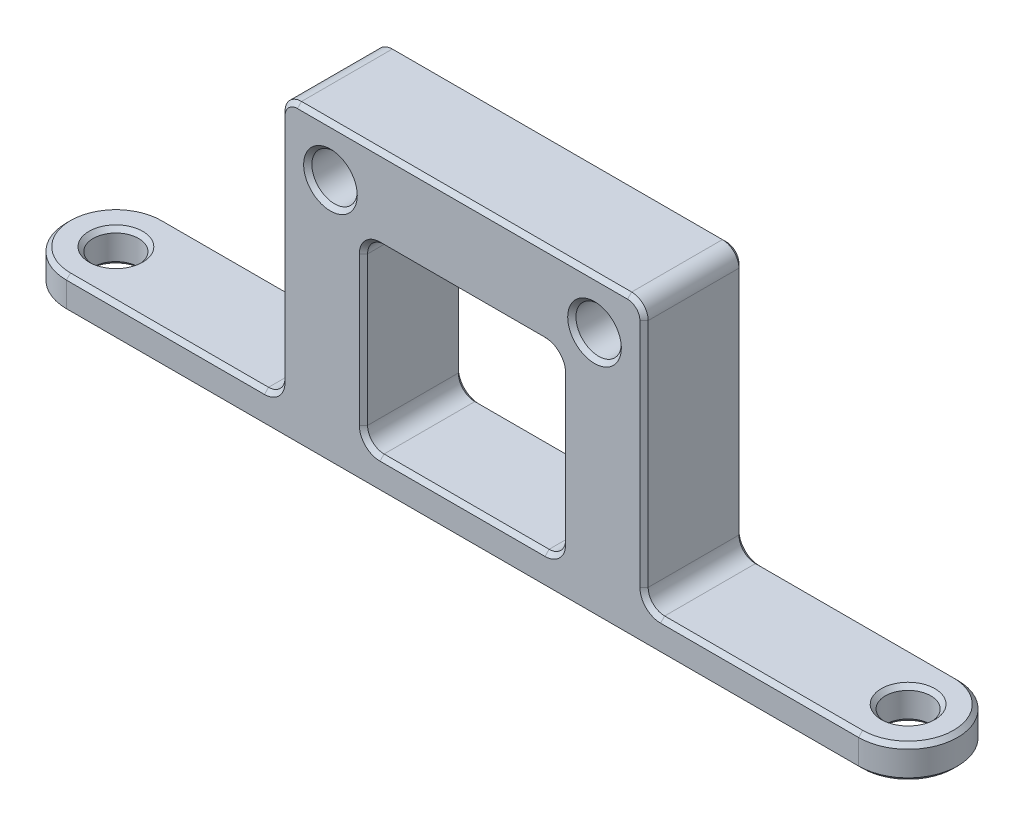
from build123d import *

# Parameters (mm, degrees)
SKETCH2_R               = 2.1828125
BOSS_EXTRUDE1_DEPTH     = 3.175
SKETCH3_W               = 36.843225838
SKETCH3_H               = 9.525
BOSS_EXTRUDE2_DEPTH     = 25.4
CUT_EXTRUDE1_DEPTH      = 53.3875
CUT_EXTRUDE1_DEPTH_BACK = 53.3875
SKETCH4_R               = 2.1828125
SKETCH4_W               = 0.959112919
SKETCH4_H               = 25.4
SKETCH4_W_2             = 19.05
SKETCH4_H_2             = 17.4625
FILLET1_R               = 1.5875
CHAMFER1_SIZE           = 0.396875


with BuildPart() as part:
    # Sketch2 → Boss-Extrude1 (new body)
    with BuildSketch(Plane(origin=(0, 0, 0), x_dir=(1, 0, 0), z_dir=(0, 1, 0))):
        with BuildLine():
            Line((-38.1, 4.7625), (38.1, 4.7625))
            ThreePointArc((38.1, 4.7625), (42.8625, 0), (38.1, -4.7625))
            Line((38.1, -4.7625), (-38.1, -4.7625))
            ThreePointArc((-38.1, -4.7625), (-42.8625, 0), (-38.1, 4.7625))
        make_face()
        with Locations(Location((-38.1, 0, 0), (0, 0, 270))):
            Circle(SKETCH2_R, mode=Mode.SUBTRACT)
        with Locations(Location((38.1, 0, 0), (0, 0, 270))):
            Circle(SKETCH2_R, mode=Mode.SUBTRACT)
    extrude(amount=BOSS_EXTRUDE1_DEPTH)

    # Sketch3 → Boss-Extrude2 (add)
    with BuildSketch(Plane(origin=(0, 3.175, 0), x_dir=(1, 0, 0), z_dir=(0, 1, 0))):
        Rectangle(SKETCH3_W, SKETCH3_H)
    extrude(amount=BOSS_EXTRUDE2_DEPTH)

    # Sketch4 → Cut-Extrude1 (cut, two sides: drawn at the far end of the back side and taken through both)
    with BuildSketch(Plane.XY.offset(4.7625).offset(-CUT_EXTRUDE1_DEPTH_BACK)):
        with Locations((-12.7, 23.8125)):
            Circle(SKETCH4_R)
        with Locations((12.7, 23.8125)):
            Circle(SKETCH4_R)
        with Locations((-17.94205646, 15.875)):
            Rectangle(SKETCH4_W, SKETCH4_H)
        with Locations((17.94205646, 15.875)):
            Rectangle(SKETCH4_W, SKETCH4_H)
        with Locations((0, 11.90625)):
            Rectangle(SKETCH4_W_2, SKETCH4_H_2)
    extrude(amount=CUT_EXTRUDE1_DEPTH + CUT_EXTRUDE1_DEPTH_BACK, mode=Mode.SUBTRACT)

    # Fillet1
    fillet1_edges = [part.edges().sort_by_distance(p)[0] for p in [
        (-17.4625, 3.175, 0),
        (-17.4625, 28.575, 0),
        (17.4625, 28.575, 0),
        (17.4625, 3.175, 0),
        (-9.525, 3.175, 0),
        (-9.525, 20.6375, 0),
        (9.525, 20.6375, 0),
        (9.525, 3.175, 0),
    ]]
    fillet(fillet1_edges, radius=FILLET1_R)

    # Chamfer1
    chamfer1_edges = [part.edges().sort_by_distance(p)[0] for p in [
        (0, 28.575, -4.7625),
        (0, 28.575, 4.7625),
        (0, 3.175, 4.7625),
        (-9.525, 11.90625, 4.7625),
        (0, 20.6375, 4.7625),
        (9.525, 11.90625, 4.7625),
        (-17.4625, 15.875, 4.7625),
        (28.575, 3.175, 4.7625),
        (17.4625, 15.875, 4.7625),
        (16.997532015, 28.110032015, 4.7625),
        (-16.997532015, 28.110032015, 4.7625),
        (-17.4625, 15.875, -4.7625),
        (0, 20.6375, -4.7625),
        (-9.525, 11.90625, -4.7625),
        (0, 3.175, -4.7625),
        (9.525, 11.90625, -4.7625),
        (-28.575, 3.175, -4.7625),
        (17.4625, 15.875, -4.7625),
        (16.997532015, 28.110032015, -4.7625),
        (-16.997532015, 28.110032015, -4.7625),
        (-38.1, 0, -2.1828125),
        (-17.927467985, 3.639967985, 4.7625),
        (-38.1, 3.175, -2.1828125),
        (-17.927467985, 3.639967985, -4.7625),
        (17.927467985, 3.639967985, 4.7625),
        (17.927467985, 3.639967985, -4.7625),
        (-9.060032015, 20.172532015, 4.7625),
        (42.8625, 3.175, 0),
        (-9.060032015, 20.172532015, -4.7625),
        (9.060032015, 20.172532015, 4.7625),
        (9.060032015, 20.172532015, -4.7625),
        (9.060032015, 3.639967985, 4.7625),
        (9.060032015, 3.639967985, -4.7625),
        (-9.060032015, 3.639967985, 4.7625),
        (-9.060032015, 3.639967985, -4.7625),
        (38.1, 0, -2.1828125),
        (38.1, 3.175, -2.1828125),
        (28.575, 3.175, -4.7625),
        (10.5171875, 23.8125, -4.7625),
        (10.5171875, 23.8125, 4.7625),
        (-42.8625, 3.175, 0),
        (0, 0, -4.7625),
        (42.8625, 0, 0),
        (0, 0, 4.7625),
        (-42.8625, 0, 0),
        (-14.8828125, 23.8125, -4.7625),
        (-14.8828125, 23.8125, 4.7625),
        (-28.575, 3.175, 4.7625),
    ]]
    chamfer(chamfer1_edges, length=CHAMFER1_SIZE)


solid = part.part
